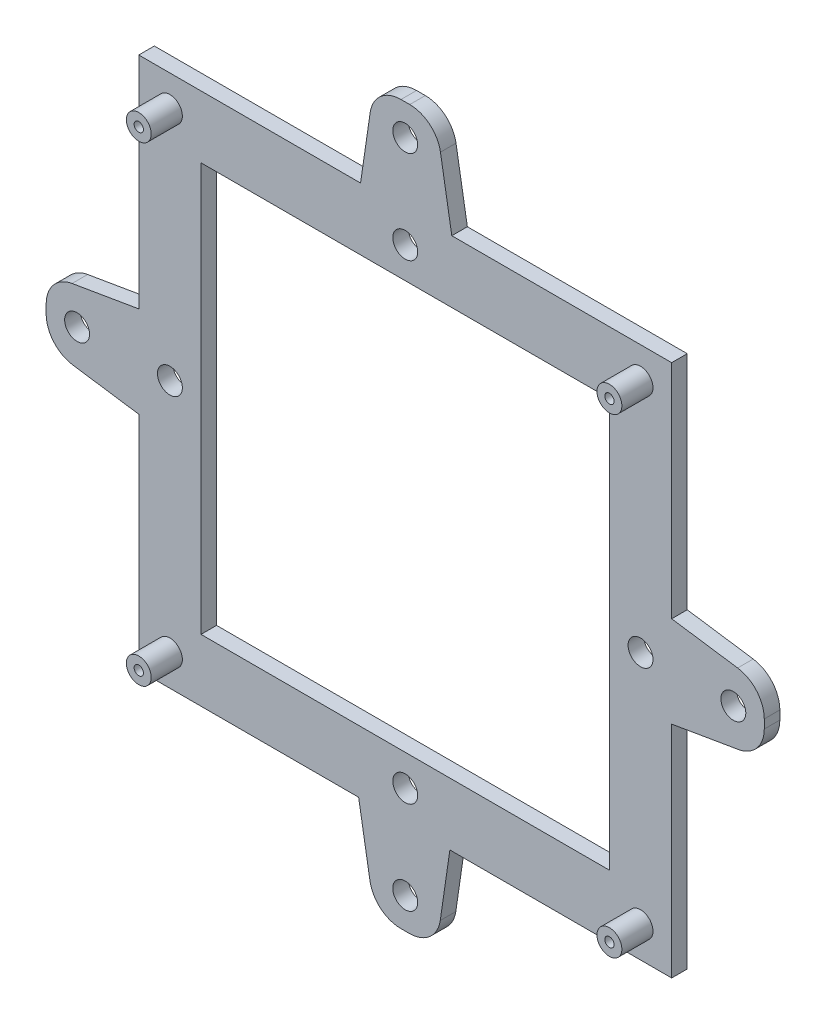
from build123d import *

# Parameters (mm, degrees)
SKETCH1_W           = 108.712
SKETCH1_H           = 108.712
SKETCH1_R           = 2.54
SKETCH1_R_2         = 3.175
SKETCH1_W_2         = 83.312
SKETCH1_H_2         = 83.312
SKETCH1_R_3         = 0.94996
SKETCH1_R_4         = 0.95
BOSS_EXTRUDE1_DEPTH = 3.175
SKETCH2_R           = 2.54
SKETCH2_R_2         = 0.95
BOSS_EXTRUDE2_DEPTH = 6.35
SKETCH3_R           = 2.54
BOSS_EXTRUDE3_DEPTH = 3.175


with BuildPart() as part:
    # Sketch1 → Boss-Extrude1 (new body)
    # profile 1 of 9: a face of its own
    with BuildSketch(Plane.XY):
        with Locations((1506.110862596, -71.75697427)):
            Rectangle(SKETCH1_W, SKETCH1_H)
        with Locations((1506.110862596, -23.75097427)):
            Circle(SKETCH1_R, mode=Mode.SUBTRACT)
        with Locations((1458.104862596, -23.75097427)):
            Circle(SKETCH1_R_2, mode=Mode.SUBTRACT)
        with Locations((1506.110862596, -119.76297427)):
            Circle(SKETCH1_R, mode=Mode.SUBTRACT)
        with Locations((1554.116862596, -71.75697427)):
            Circle(SKETCH1_R, mode=Mode.SUBTRACT)
        with Locations((1458.104862596, -71.75697427)):
            Circle(SKETCH1_R, mode=Mode.SUBTRACT)
        with Locations((1458.104862596, -119.76297427)):
            Circle(SKETCH1_R, mode=Mode.SUBTRACT)
        with Locations((1554.116862596, -119.76297427)):
            Circle(SKETCH1_R, mode=Mode.SUBTRACT)
        with Locations((1554.116862596, -23.75097427)):
            Circle(SKETCH1_R, mode=Mode.SUBTRACT)
        with Locations((1506.110862596, -71.75697427)):
            Rectangle(SKETCH1_W_2, SKETCH1_H_2, mode=Mode.SUBTRACT)
    # profile 2 of 9: a face of its own
    with BuildSketch(Plane.XY):
        with Locations((1554.116862596, -119.76297427)):
            Circle(SKETCH1_R)
        with Locations((1554.116862596, -119.76297427)):
            Circle(SKETCH1_R_3, mode=Mode.SUBTRACT)
    # profile 3 of 9: a face of its own
    with BuildSketch(Plane.XY):
        with Locations((1554.116862596, -119.76297427)):
            Circle(SKETCH1_R_3)
    # profile 4 of 9: a face of its own
    with BuildSketch(Plane.XY):
        with Locations((1458.104862596, -119.76297427)):
            Circle(SKETCH1_R)
        with Locations((1458.104862596, -119.76297427)):
            Circle(SKETCH1_R_3, mode=Mode.SUBTRACT)
    # profile 5 of 9: a face of its own
    with BuildSketch(Plane.XY):
        with Locations((1458.104862596, -119.76297427)):
            Circle(SKETCH1_R_3)
    # profile 6 of 9: a face of its own
    with BuildSketch(Plane.XY):
        with Locations((1458.104862596, -23.75097427)):
            Circle(SKETCH1_R_2)
        with Locations((1458.104862596, -23.75097427)):
            Circle(SKETCH1_R_4, mode=Mode.SUBTRACT)
    # profile 7 of 9: a face of its own
    with BuildSketch(Plane.XY):
        with Locations((1458.104862596, -23.75097427)):
            Circle(SKETCH1_R_4)
    # profile 8 of 9: a face of its own
    with BuildSketch(Plane.XY):
        with Locations((1554.116862596, -23.75097427)):
            Circle(SKETCH1_R)
        with Locations((1554.116862596, -23.75097427)):
            Circle(SKETCH1_R_3, mode=Mode.SUBTRACT)
    # profile 9 of 9: a face of its own
    with BuildSketch(Plane.XY):
        with Locations((1554.116862596, -23.75097427)):
            Circle(SKETCH1_R_3)
    extrude(amount=BOSS_EXTRUDE1_DEPTH)

    # Sketch2 → Boss-Extrude2 (add)
    # profile 1 of 4: a face of its own
    with BuildSketch(Plane.XY.offset(3.175)):
        with Locations((1554.116862596, -119.76297427)):
            Circle(SKETCH2_R)
        with Locations((1554.116862596, -119.76297427)):
            Circle(SKETCH2_R_2, mode=Mode.SUBTRACT)
    # profile 2 of 4: a face of its own
    with BuildSketch(Plane.XY.offset(3.175)):
        with Locations((1554.116862596, -23.75097427)):
            Circle(SKETCH2_R)
        with Locations((1554.116862596, -23.75097427)):
            Circle(SKETCH2_R_2, mode=Mode.SUBTRACT)
    # profile 3 of 4: a face of its own
    with BuildSketch(Plane.XY.offset(3.175)):
        with Locations((1458.104862596, -23.75097427)):
            Circle(SKETCH2_R)
        with Locations((1458.104862596, -23.75097427)):
            Circle(SKETCH2_R_2, mode=Mode.SUBTRACT)
    # profile 4 of 4: a face of its own
    with BuildSketch(Plane.XY.offset(3.175)):
        with Locations((1458.104862596, -119.76297427)):
            Circle(SKETCH2_R)
        with Locations((1458.104862596, -119.76297427)):
            Circle(SKETCH2_R_2, mode=Mode.SUBTRACT)
    extrude(amount=BOSS_EXTRUDE2_DEPTH)

    # Sketch3 → Boss-Extrude3 (add)
    # profile 1 of 4: a face of its own
    with BuildSketch(Plane.XY.offset(3.175)):
        with BuildLine():
            Line((1513.299858853, -3.795295248), (1515.613291339, -17.40097427))
            Line((1515.613291339, -17.40097427), (1497.000613972, -17.40097427))
            Line((1497.000613972, -17.40097427), (1498.967188582, -3.941668388))
            ThreePointArc((1498.967188582, -3.941668388), (1501.097595235, -0.05597519), (1505.250472182, 1.490264506))
            Line((1505.250472182, 1.490264506), (1506.110862596, 1.490264506))
            Line((1506.110862596, 1.490264506), (1507.039709736, 1.490264506))
            ThreePointArc((1507.039709736, 1.490264506), (1511.136251231, -0.007844339), (1513.299858853, -3.795295248))
        make_face()
        with Locations((1506.110862596, -4.818719074)):
            Circle(SKETCH3_R, mode=Mode.SUBTRACT)
    # profile 2 of 4: a face of its own
    with BuildSketch(Plane.XY.offset(3.175)):
        with BuildLine():
            Line((1432.86362382, -71.75697427), (1432.86362382, -70.82812713))
            ThreePointArc((1432.86362382, -70.82812713), (1434.361732665, -66.731585635), (1438.149183574, -64.567978013))
            Line((1438.149183574, -64.567978013), (1451.754862596, -62.254545527))
            Line((1451.754862596, -62.254545527), (1451.754862596, -80.867222895))
            Line((1451.754862596, -80.867222895), (1438.295556714, -78.900648284))
            ThreePointArc((1438.295556714, -78.900648284), (1434.409863516, -76.770241631), (1432.86362382, -72.617364684))
            Line((1432.86362382, -72.617364684), (1432.86362382, -71.75697427))
        make_face()
        with Locations((1439.1726074, -71.75697427)):
            Circle(SKETCH3_R, mode=Mode.SUBTRACT)
    # profile 3 of 4: a face of its own
    with BuildSketch(Plane.XY.offset(3.175)):
        with BuildLine():
            Line((1574.072541618, -78.945970527), (1560.466862596, -81.259403013))
            Line((1560.466862596, -81.259403013), (1560.466862596, -62.646725646))
            Line((1560.466862596, -62.646725646), (1573.926168478, -64.613300257))
            ThreePointArc((1573.926168478, -64.613300257), (1577.811861676, -66.743706909), (1579.358101372, -70.896583856))
            Line((1579.358101372, -70.896583856), (1579.358101372, -71.75697427))
            Line((1579.358101372, -71.75697427), (1579.358101372, -72.68582141))
            ThreePointArc((1579.358101372, -72.68582141), (1577.859992527, -76.782362905), (1574.072541618, -78.945970527))
        make_face()
        with Locations((1573.049117792, -71.75697427)):
            Circle(SKETCH3_R, mode=Mode.SUBTRACT)
    # profile 4 of 4: a face of its own
    with BuildSketch(Plane.XY.offset(3.175)):
        with BuildLine():
            Line((1498.921866339, -139.718653293), (1496.608433853, -126.11297427))
            Line((1496.608433853, -126.11297427), (1515.22111122, -126.11297427))
            Line((1515.22111122, -126.11297427), (1513.254536609, -139.572280152))
            ThreePointArc((1513.254536609, -139.572280152), (1511.124129957, -143.45797335), (1506.97125301, -145.004213046))
            Line((1506.97125301, -145.004213046), (1506.110862596, -145.004213046))
            Line((1506.110862596, -145.004213046), (1505.182015456, -145.004213046))
            ThreePointArc((1505.182015456, -145.004213046), (1501.085473961, -143.506104201), (1498.921866339, -139.718653293))
        make_face()
        with Locations((1506.110862596, -138.695229466)):
            Circle(SKETCH3_R, mode=Mode.SUBTRACT)
    extrude(amount=-BOSS_EXTRUDE3_DEPTH)


solid = part.part
